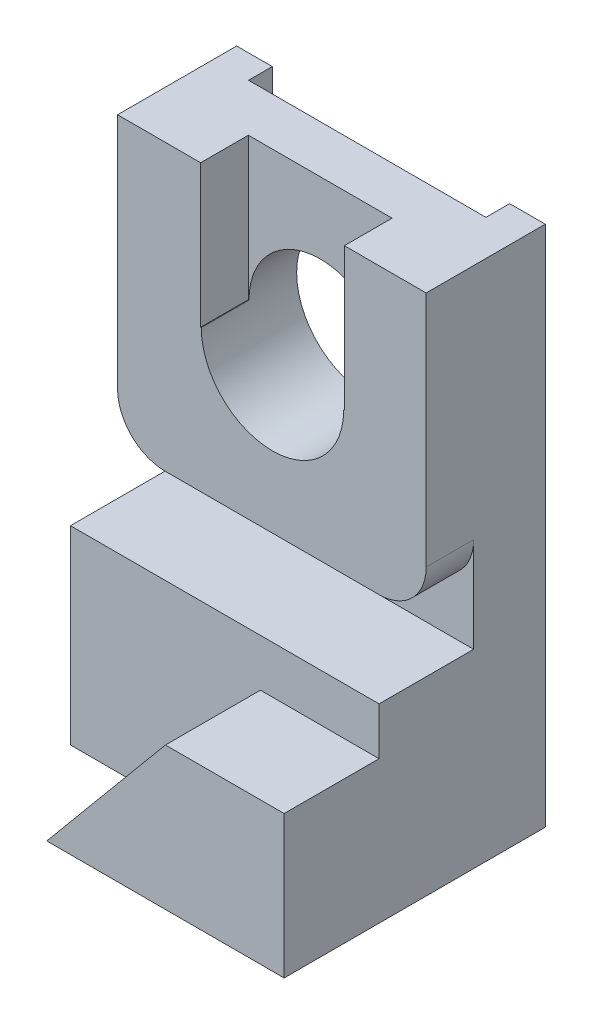
from build123d import *

# Parameters (mm, degrees)
ESBO_O1_W                = 130
ESBO_O1_H                = 80
RESSALTO_EXTRUS_O1_DEPTH = 70
RESSALTO_EXTRUS_O2_DEPTH = 40
ESBO_O3_W                = 130
ESBO_O3_H                = 30.168266629
RESSALTO_EXTRUS_O3_DEPTH = 140
ESBO_O4_W                = 130
ESBO_O4_H                = 120
RESSALTO_EXTRUS_O4_DEPTH = 20
ESBO_O5_W                = 100
ESBO_O5_H                = 10
CORTE_EXTRUS_O1_DEPTH    = 260
FILETE3_R                = 20
FILETE4_R                = 20
ESBO_O12_W               = 60.538405015
ESBO_O12_H               = 20.084133314
CORTE_EXTRUS_O3_DEPTH    = 60
ESBO_O13_R               = 30
CORTE_EXTRUS_O4_DEPTH    = 60


with BuildPart() as part:
    # Esboço1 → Ressalto-extrusão1 (new body)
    with BuildSketch(Plane.XY):
        with Locations((65, 40)):
            Rectangle(ESBO_O1_W, ESBO_O1_H)
    extrude(amount=RESSALTO_EXTRUS_O1_DEPTH)

    # Esboço2 → Ressalto-extrusão2 (add)
    with BuildSketch(Plane.XY.offset(70)):
        Polygon((130, 0), (30, 0), (80, 60.000756035), (130, 60.000756035), align=None)
    extrude(amount=RESSALTO_EXTRUS_O2_DEPTH)

    # Esboço3 → Ressalto-extrusão3 (add)
    with BuildSketch(Plane(origin=(0, 80, 0), x_dir=(1, 0, 0), z_dir=(0, 1, 0))):
        with Locations((65, -15.084133315)):
            Rectangle(ESBO_O3_W, ESBO_O3_H)
    extrude(amount=RESSALTO_EXTRUS_O3_DEPTH)

    # Esboço4 → Ressalto-extrusão4 (add)
    with BuildSketch(Plane.XY.offset(30.168266629)):
        with Locations((65, 160)):
            Rectangle(ESBO_O4_W, ESBO_O4_H)
    extrude(amount=RESSALTO_EXTRUS_O4_DEPTH)

    # Esboço5 → Corte-extrusão1 (cut)
    with BuildSketch(Plane(origin=(0, 220, 0), x_dir=(1, 0, 0), z_dir=(0, 1, 0))):
        with Locations((65, -5)):
            Rectangle(ESBO_O5_W, ESBO_O5_H)
    extrude(amount=-CORTE_EXTRUS_O1_DEPTH, mode=Mode.SUBTRACT)

    # Filete3
    filete3_edges = [part.edges().sort_by_distance(p)[0] for p in [
        (0, 100, 40.168266629),
    ]]
    fillet(filete3_edges, radius=FILETE3_R)

    # Filete4
    filete4_edges = [part.edges().sort_by_distance(p)[0] for p in [
        (130, 100, 40.168266629),
    ]]
    fillet(filete4_edges, radius=FILETE4_R)

    # Esboço12 → Corte-extrusão3 (cut)
    with BuildSketch(Plane(origin=(0, 220, 0), x_dir=(1, 0, 0), z_dir=(0, 1, 0))):
        with Locations((65.269202508, -40.126199972)):
            Rectangle(ESBO_O12_W, ESBO_O12_H)
    extrude(amount=-CORTE_EXTRUS_O3_DEPTH, mode=Mode.SUBTRACT)

    # Esboço13 → Corte-extrusão4 (cut)
    with BuildSketch(Plane.XY.offset(50.168266629)):
        with Locations((65.269202508, 160)):
            Circle(ESBO_O13_R)
    extrude(amount=-CORTE_EXTRUS_O4_DEPTH, mode=Mode.SUBTRACT)


solid = part.part
